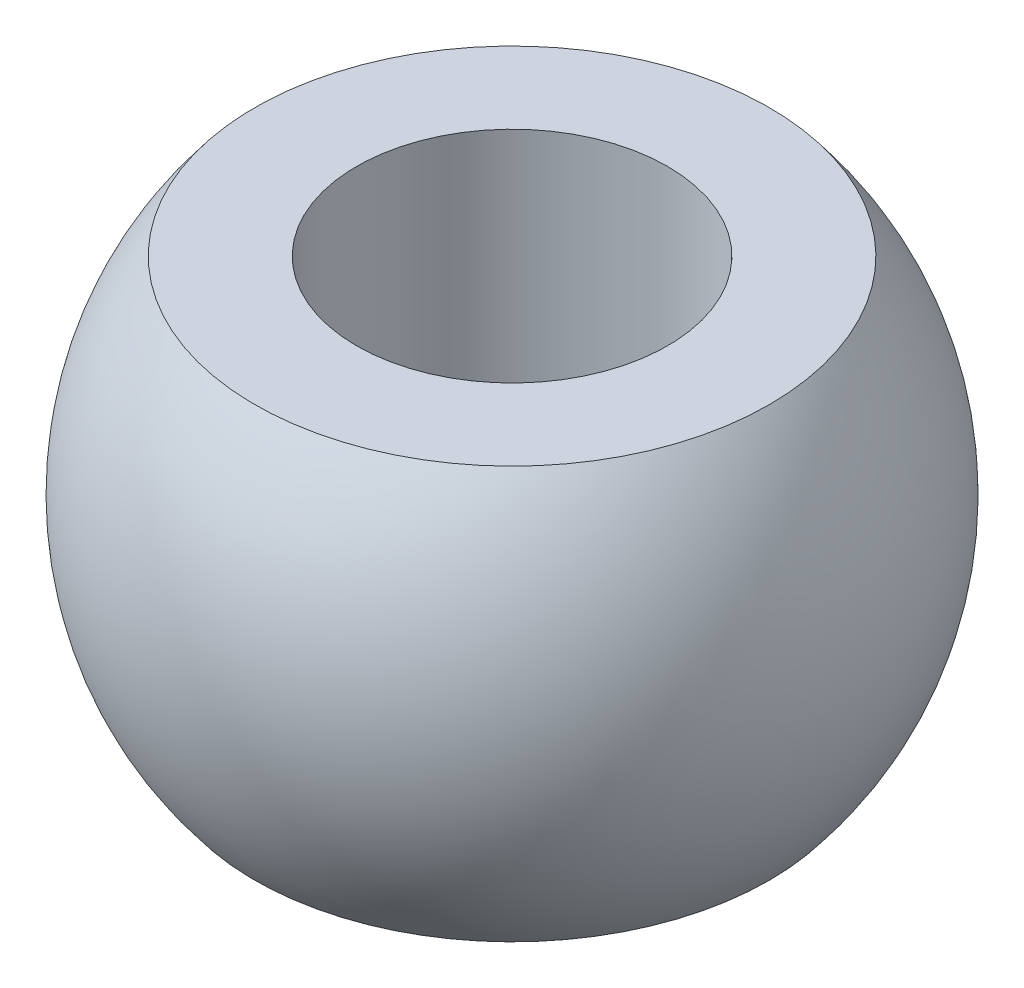
from build123d import *


with BuildPart() as part:
    # Sketch1 → Revolve2 (revolve)
    with BuildSketch(Plane.XY):
        with BuildLine():
            Line((5, 6.625), (8.274622348, 6.625))
            ThreePointArc((8.274622348, 6.625), (10.6, 0), (8.274622348, -6.625))
            Line((8.274622348, -6.625), (5, -6.625))
            Line((5, -6.625), (5, 6.625))
        make_face()
    revolve(axis=Axis((0, 6.625, 0), (0, -1, 0)))


solid = part.part
